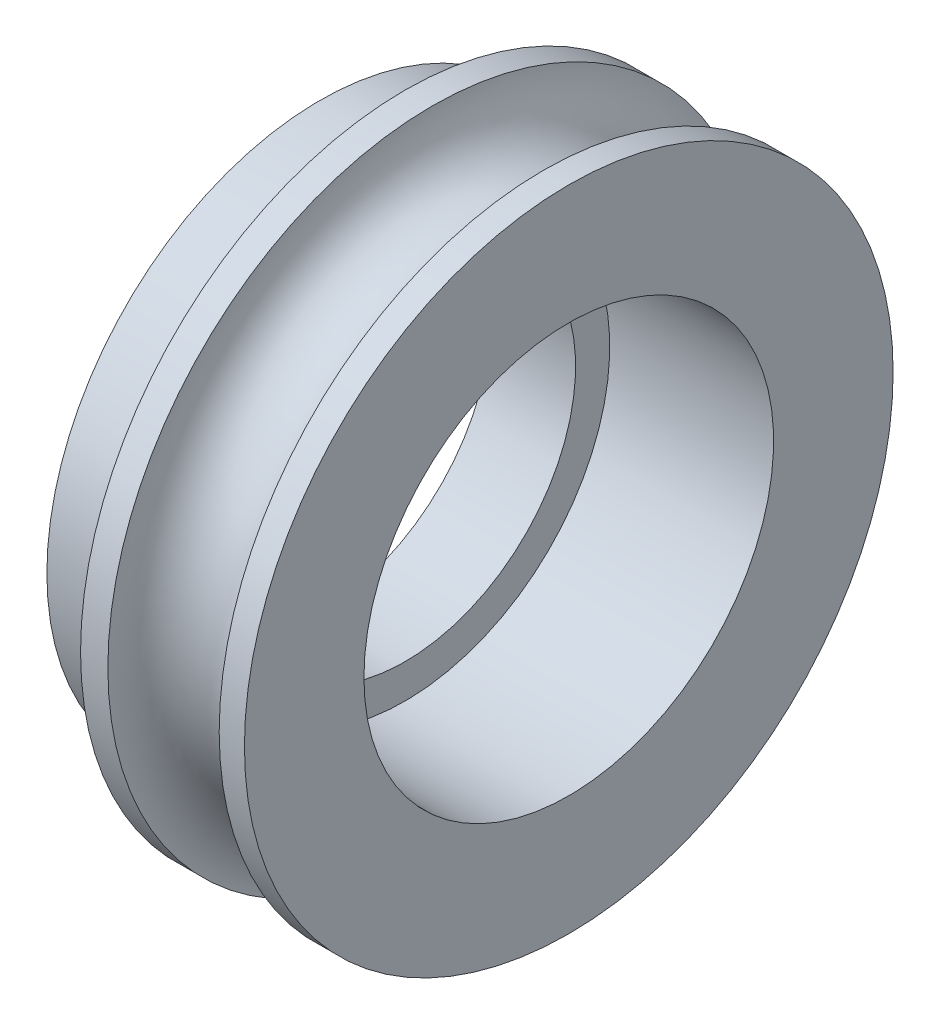
from build123d import *

# Parameters (mm, degrees)
SKETCH_2_R          = 8.712878419
CUT_EXTRUDE_1_DEPTH = 0.7


with BuildPart() as part:
    # 草图1 → 旋转1 (revolve)
    with BuildSketch(Plane.XY, mode=Mode.PRIVATE) as revolve_1_sk:
        with BuildLine():
            Line((0, -9.5), (0.8, -9.5))
            ThreePointArc((0.8, -9.5), (2.430127754, -7.869872246), (4.060255508, -9.5))
            Line((4.060255508, -9.5), (4.8, -9.5))
            Line((4.8, -9.5), (4.8, -6))
            Line((4.8, -6), (0, -6))
            Line((0, -6), (0, -5))
            Line((0, -5), (-3.185969682, -5))
            Line((-3.185969682, -5), (-3.185969682, -8))
            Line((-3.185969682, -8), (0, -8))
            Line((0, -8), (0, -9.5))
        make_face()
    revolve(revolve_1_sk.sketch.rotate(Axis((-3.185969682, 0, 0), (1, 0, 0)), 270), axis=Axis((-3.185969682, 0, 0), (1, 0, 0)))

    # 草图2 → 切除-拉伸1 (cut)
    with BuildSketch(Plane.ZY.offset(3.185969682)):
        Circle(SKETCH_2_R)
    extrude(amount=-CUT_EXTRUDE_1_DEPTH, mode=Mode.SUBTRACT)


solid = part.part
